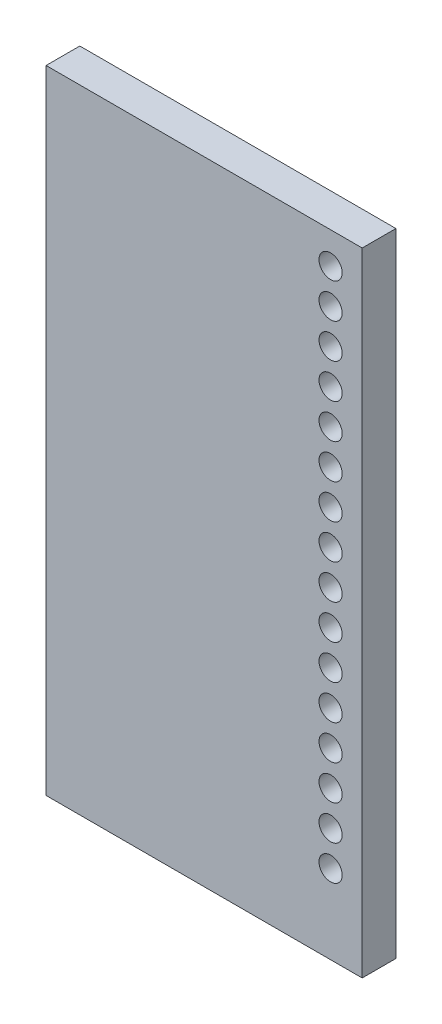
from build123d import *

# Parameters (mm, degrees)
SKETCH1_W                 = 150
SKETCH1_H                 = 300
BOSS_EXTRUDE1_DEPTH       = 16
SKETCH2_R                 = 5.5
CUT_EXTRUDE4_DEPTH        = 310.646572724
LPATTERN1_COUNT           = 16
LPATTERN1_PITCH           = 16.5
F_8_36_TAPPED_HOLE1_D     = 3.4544
F_8_36_TAPPED_HOLE1_DEPTH = 25
F_8_36_TAPPED_HOLE1_TIP   = 1.037806461


with BuildPart() as part:
    # Sketch1 → Boss-Extrude1 (new body)
    with BuildSketch(Plane.XY):
        with Locations((0, 150)):
            Rectangle(SKETCH1_W, SKETCH1_H)
    extrude(amount=BOSS_EXTRUDE1_DEPTH)

    # Sketch2 → Cut-Extrude4 (cut, through all)
    with BuildSketch(Plane.XY.offset(16)):
        with Locations((60, 37.5)):
            Circle(SKETCH2_R)
    cut_extrude4 = extrude(amount=-CUT_EXTRUDE4_DEPTH, mode=Mode.SUBTRACT)

    # LPattern1: Cut-Extrude4 ×16
    with Locations(*[(0, i * LPATTERN1_PITCH, 0) for i in range(1, LPATTERN1_COUNT)]):
        add(cut_extrude4, mode=Mode.SUBTRACT)

    # #8-36 Tapped Hole1
    with Locations(Plane(origin=(0, 0, 0), x_dir=(-1, 0, 0), z_dir=(0, -1, 0))):
        with Locations((-60, -8), (0, -8), (60, -8)):
            Hole(F_8_36_TAPPED_HOLE1_D / 2, depth=F_8_36_TAPPED_HOLE1_DEPTH)
            with Locations((0, 0, -(F_8_36_TAPPED_HOLE1_DEPTH + F_8_36_TAPPED_HOLE1_TIP / 2))):  # 118° drill point
                Cone(0, F_8_36_TAPPED_HOLE1_D / 2, F_8_36_TAPPED_HOLE1_TIP, mode=Mode.SUBTRACT)


solid = part.part
